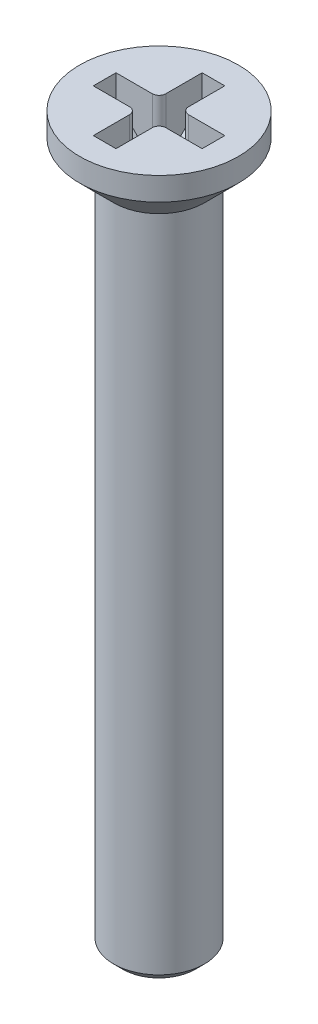
from build123d import *

# Parameters (mm, degrees)
SKETCH_2_W               = 0.5
SKETCH_2_H               = 1.2
CUT_EXTRUDE_1_DEPTH      = 0.5
CUT_EXTRUDE_2_DEPTH      = 0.5
PATTERN_CIRCULAR_1_COUNT = 4
FILLET_1_R               = 0.15


with BuildPart() as part:
    # 草图1 → 旋转1 (revolve)
    with BuildSketch(Plane.XY, mode=Mode.PRIVATE) as revolve_1_sk:
        Polygon((0, 2.689659811), (-1.75, 2.689659811), (-1.75, 2.179659811), (-1, 1.429659811), (-1, -13.110340189), (-0.8, -13.310340189), (0, -13.310340189), align=None)
    revolve(revolve_1_sk.sketch.rotate(Axis((0, -3.769198969, 0), (0, 1, 0)), 270), axis=Axis((0, -3.769198969, 0), (0, 1, 0)))

    # 草图2 → 切除-拉伸1 (cut)
    with BuildSketch(Plane(origin=(0, 2.689659811, 0), x_dir=(1, 0, 0), z_dir=(0, 1, 0))):
        with Locations((0, 0.6)):
            Rectangle(SKETCH_2_W, SKETCH_2_H)
    cut_extrude_1 = extrude(amount=-CUT_EXTRUDE_1_DEPTH, mode=Mode.SUBTRACT)

    # 草图3 → 切除-拉伸2 (cut)
    with BuildSketch(Plane(origin=(-0.25, 0, 0), x_dir=(0, 0, -1), z_dir=(1, 0, 0))):
        Polygon((0, 2.189659811), (0, 1.429659811), (0.44, 1.429659811), (1.2, 2.189659811), align=None)
    cut_extrude_2 = extrude(amount=CUT_EXTRUDE_2_DEPTH, mode=Mode.SUBTRACT)

    # 阵列(圆周)1: 切除-拉伸1, 切除-拉伸2 ×4 about axis
    pattern_circular_1_axis = Axis((0, 0, 0), (0, 1, 0))
    add([cut_extrude_1.rotate(pattern_circular_1_axis, i * 360 / PATTERN_CIRCULAR_1_COUNT) for i in range(1, PATTERN_CIRCULAR_1_COUNT)], mode=Mode.SUBTRACT)
    add([cut_extrude_2.rotate(pattern_circular_1_axis, i * 360 / PATTERN_CIRCULAR_1_COUNT) for i in range(1, PATTERN_CIRCULAR_1_COUNT)], mode=Mode.SUBTRACT)

    # 圆角1
    fillet_1_edges = [part.edges().sort_by_distance(p)[0] for p in [
        (0.25, 2.059659811, -0.25),
        (-0.25, 2.059659811, -0.25),
        (0.25, 2.059659811, 0.25),
        (-0.25, 2.059659811, 0.25),
    ]]
    fillet(fillet_1_edges, radius=FILLET_1_R)


solid = part.part
